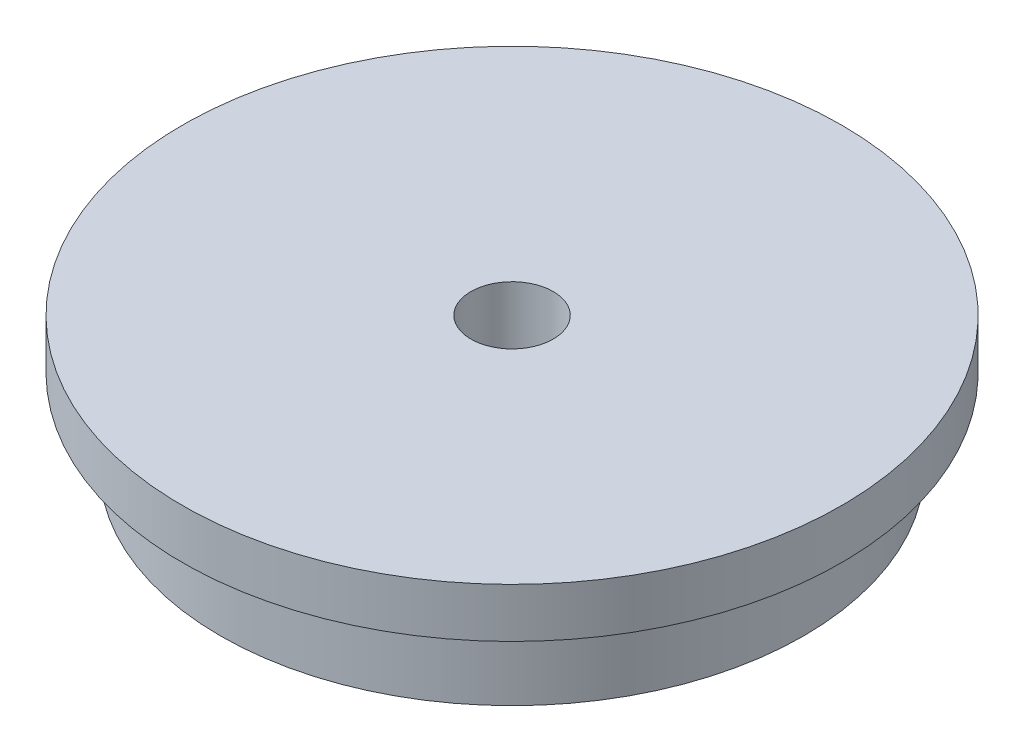
from build123d import *

# Parameters (mm, degrees)
SKETCH1_R           = 22.479
BOSS_EXTRUDE1_DEPTH = 6.35
SKETCH2_R           = 25.4
BOSS_EXTRUDE2_DEPTH = 3.81
SKETCH3_R           = 8.9916
CUT_EXTRUDE1_DEPTH  = 3.81
SKETCH4_R           = 3.175
CUT_EXTRUDE2_DEPTH  = 37.477972806


with BuildPart() as part:
    # Sketch1 → Boss-Extrude1 (new body)
    with BuildSketch(Plane(origin=(0, 0, 0), x_dir=(1, 0, 0), z_dir=(0, 1, 0))):
        with Locations(Location((0, 0, 0), (0, 0, 270))):
            Circle(SKETCH1_R)
    extrude(amount=BOSS_EXTRUDE1_DEPTH)

    # Sketch2 → Boss-Extrude2 (add)
    with BuildSketch(Plane(origin=(0, 6.35, 0), x_dir=(1, 0, 0), z_dir=(0, 1, 0))):
        with Locations(Location((0, 0, 0), (0, 0, 90))):
            Circle(SKETCH2_R)
    extrude(amount=BOSS_EXTRUDE2_DEPTH)

    # Sketch3 → Cut-Extrude1 (cut)
    with BuildSketch(Plane.XZ):
        with Locations(Location((0, 0, 0), (0, 0, 270))):
            Circle(SKETCH3_R)
    extrude(amount=-CUT_EXTRUDE1_DEPTH, mode=Mode.SUBTRACT)

    # Sketch4 → Cut-Extrude2 (cut, through all)
    with BuildSketch(Plane.XZ.offset(-3.81)):
        with Locations(Location((0, 0, 0), (0, 0, 270))):
            Circle(SKETCH4_R)
    extrude(amount=-CUT_EXTRUDE2_DEPTH, mode=Mode.SUBTRACT)


solid = part.part
